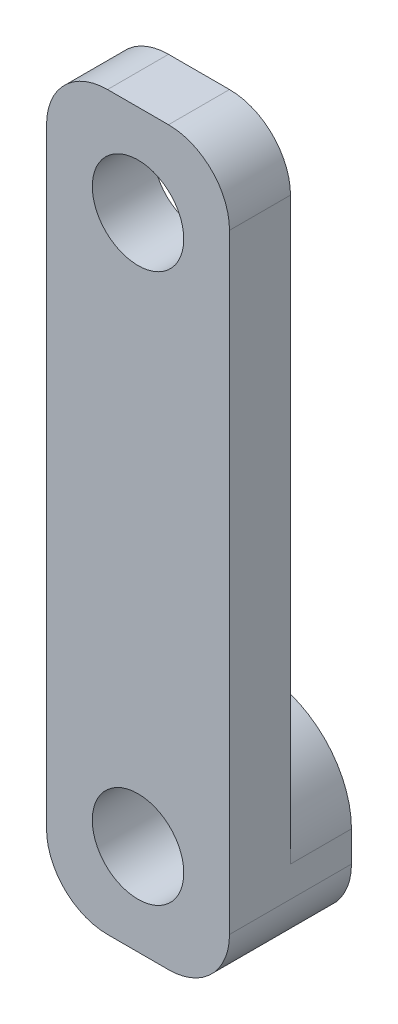
from build123d import *

# Parameters (mm, degrees)
ESQUISSE2_W        = 6
ESQUISSE2_H        = 24
ESQUISSE2_R        = 1.5
BOSS_EXTRU_2_DEPTH = 2
CONG_2_R           = 2
ESQUISSE3_R        = 3
ESQUISSE3_R_2      = 1.5
BOSS_EXTRU_3_DEPTH = 2


with BuildPart() as part:
    # Esquisse2 → Boss.-Extru.2 (new body)
    with BuildSketch(Plane.XY):
        Rectangle(ESQUISSE2_W, ESQUISSE2_H)
        with Locations((0, 9)):
            Circle(ESQUISSE2_R, mode=Mode.SUBTRACT)
        with Locations((0, -9)):
            Circle(ESQUISSE2_R, mode=Mode.SUBTRACT)
    extrude(amount=BOSS_EXTRU_2_DEPTH)

    # Congé2
    cong_2_edges = [part.edges().sort_by_distance(p)[0] for p in [
        (3, -12, 1),
        (-3, -12, 1),
        (-3, 12, 1),
        (3, 12, 1),
    ]]
    fillet(cong_2_edges, radius=CONG_2_R)

    # Esquisse3 → Boss.-Extru.3 (add)
    # profile 1 of 3: a face of its own
    with BuildSketch(Plane(origin=(0, 0, 0), x_dir=(-1, 0, 0), z_dir=(0, 0, -1))):
        with Locations((0, -9)):
            Circle(ESQUISSE3_R)
        with Locations((0, -9)):
            Circle(ESQUISSE3_R_2, mode=Mode.SUBTRACT)
    # profile 2 of 3: a face of its own
    with BuildSketch(Plane(origin=(0, 0, 0), x_dir=(-1, 0, 0), z_dir=(0, 0, -1))):
        with BuildLine():
            ThreePointArc((3, -9), (2.121320344, -11.121320344), (0, -12))
            Line((0, -12), (1, -12))
            ThreePointArc((1, -12), (2.414213562, -11.414213562), (3, -10))
            Line((3, -10), (3, -9))
        make_face()
    # profile 3 of 3: a face of its own
    with BuildSketch(Plane(origin=(0, 0, 0), x_dir=(-1, 0, 0), z_dir=(0, 0, -1))):
        with BuildLine():
            ThreePointArc((-3, -10), (-2.414213562, -11.414213562), (-1, -12))
            Line((-1, -12), (0, -12))
            ThreePointArc((0, -12), (-2.121320344, -11.121320344), (-3, -9))
            Line((-3, -9), (-3, -10))
        make_face()
    extrude(amount=BOSS_EXTRU_3_DEPTH)


solid = part.part
